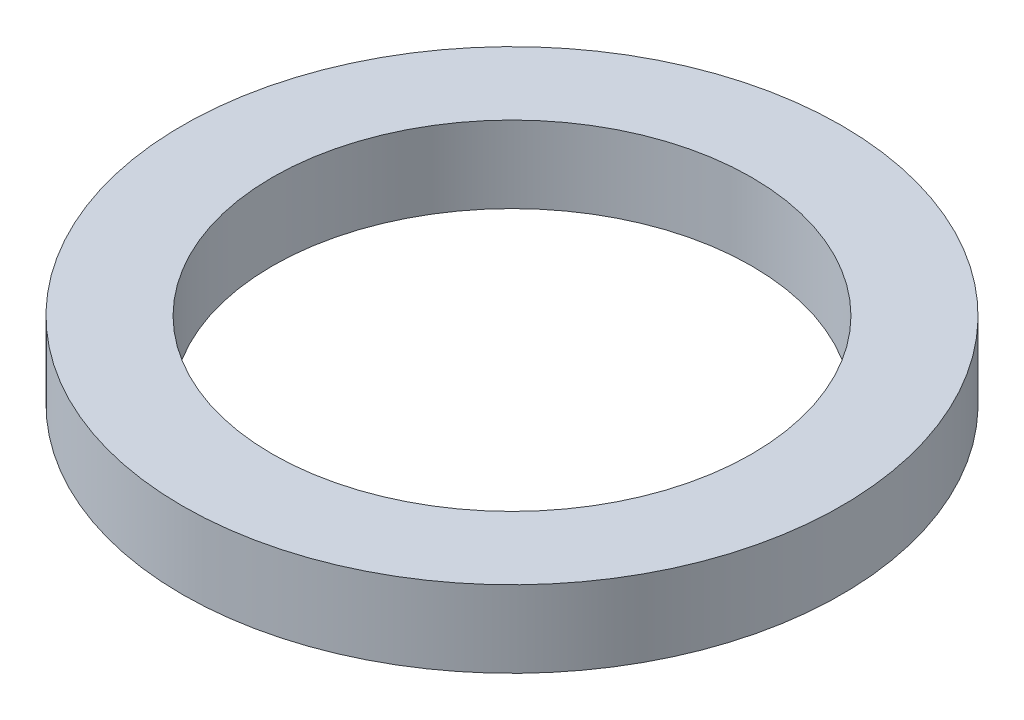
from build123d import *

# Parameters (mm, degrees)
SKETCH_1_R      = 13.75
SKETCH_1_R_2    = 10
EXTRUDE_1_DEPTH = 3.2


with BuildPart() as part:
    # 草图1 → 凸台-拉伸1 (new body)
    with BuildSketch(Plane(origin=(0, 0, 0), x_dir=(1, 0, 0), z_dir=(0, 1, 0))):
        with Locations(Location((0, 0, 0), (0, 0, 270))):
            Circle(SKETCH_1_R)
        with Locations(Location((0, 0, 0), (0, 0, 270))):
            Circle(SKETCH_1_R_2, mode=Mode.SUBTRACT)
    extrude(amount=EXTRUDE_1_DEPTH)


solid = part.part
